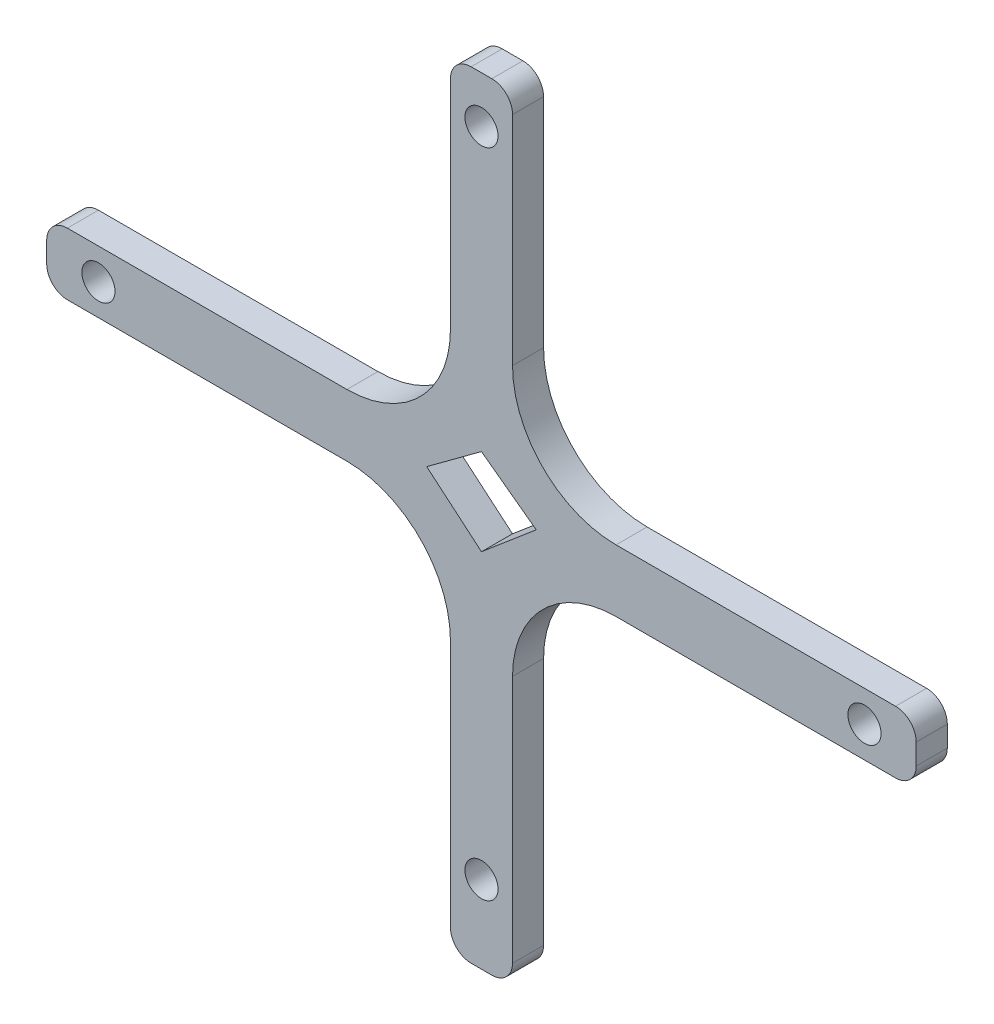
from build123d import *

# Parameters (mm, degrees)
SKETCH_1_R      = 1.6
EXTRUDE_1_DEPTH = 3
FILLET_1_R      = 2
FILLET_2_R      = 10


with BuildPart() as part:
    # 草图1 → 凸台-拉伸1 (new body)
    with BuildSketch(Plane.XY):
        Polygon((0, 0), (6, 0), (6, 36), (45, 36), (45, 42), (6, 42), (6, 75), (0, 75), (0, 42), (-39, 42), (-39, 36), (0, 36), align=None)
        with Locations((40, 39)):
            Circle(SKETCH_1_R, mode=Mode.SUBTRACT)
        with Locations((-34, 39)):
            Circle(SKETCH_1_R, mode=Mode.SUBTRACT)
        with Locations((3, 7.5)):
            Circle(SKETCH_1_R, mode=Mode.SUBTRACT)
        with Locations((3, 70.5)):
            Circle(SKETCH_1_R, mode=Mode.SUBTRACT)
        Polygon((3, 43.306086205), (-2.288898942, 39.401411526), (3, 34.92685231), (8.288898942, 39.401411526), align=None, mode=Mode.SUBTRACT)
    extrude(amount=EXTRUDE_1_DEPTH)

    # 圆角1
    fillet_1_edges = [part.edges().sort_by_distance(p)[0] for p in [
        (-39, 36, 1.5),
        (-39, 42, 1.5),
        (0, 75, 1.5),
        (6, 75, 1.5),
        (45, 42, 1.5),
        (45, 36, 1.5),
        (6, 0, 1.5),
        (0, 0, 1.5),
    ]]
    fillet(fillet_1_edges, radius=FILLET_1_R)

    # 圆角2
    fillet_2_edges = [part.edges().sort_by_distance(p)[0] for p in [
        (0, 36, 1.5),
        (0, 42, 1.5),
        (6, 42, 1.5),
        (6, 36, 1.5),
    ]]
    fillet(fillet_2_edges, radius=FILLET_2_R)


solid = part.part
